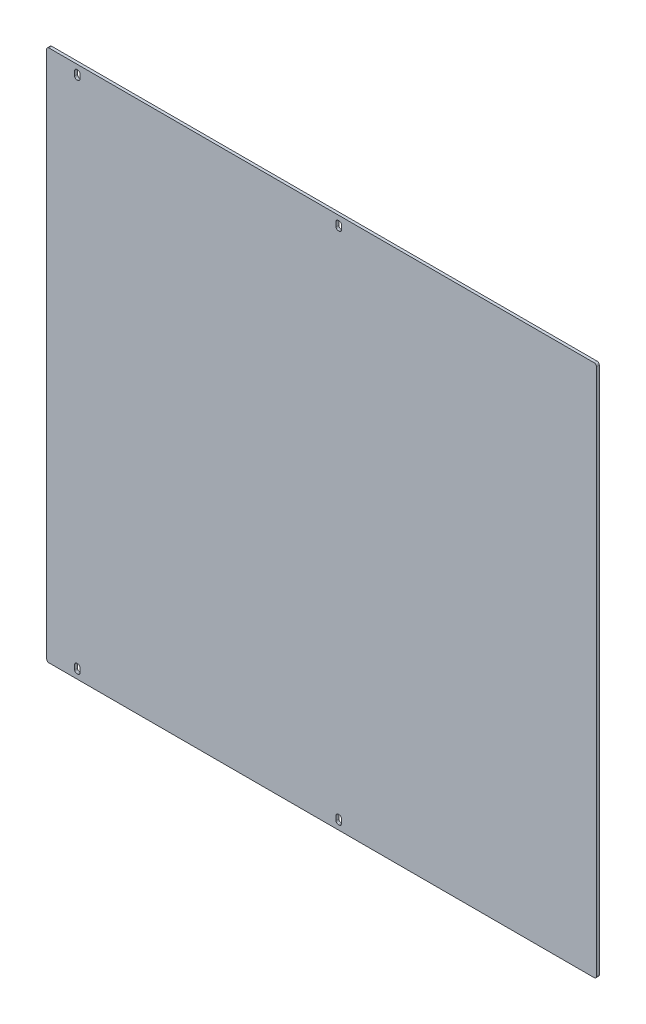
from build123d import *

# Parameters (mm, degrees)
SKETCH1_W           = 609.6
SKETCH1_H           = 590.425
BOSS_EXTRUDE1_DEPTH = 3.175
FILLET1_R           = 2.54
CUT_EXTRUDE1_DEPTH  = 3.175


with BuildPart() as part:
    # Sketch1 → Boss-Extrude1 (new body)
    with BuildSketch(Plane.XY):
        with Locations((79.823295573, -34.486097285)):
            Rectangle(SKETCH1_W, SKETCH1_H)
    extrude(amount=BOSS_EXTRUDE1_DEPTH)

    # Fillet1
    fillet1_edges = [part.edges().sort_by_distance(p)[0] for p in [
        (-224.976704427, 260.726402715, 1.5875),
        (-224.976704427, -329.698597285, 1.5875),
        (384.623295573, -329.698597285, 1.5875),
        (384.623295573, 260.726402715, 1.5875),
    ]]
    fillet(fillet1_edges, radius=FILLET1_R)

    # Sketch2 → Cut-Extrude1 (cut)
    with BuildSketch(Plane.XY.offset(3.175)):
        with BuildLine():
            Line((-190.476704427, 245.604402715), (-191.476704427, 245.604402715))
            ThreePointArc((-191.476704427, 245.604402715), (-193.24447138, 246.336635762), (-193.976704427, 248.104402715))
            Line((-193.976704427, 248.104402715), (-193.976704427, 253.104402715))
            ThreePointArc((-193.976704427, 253.104402715), (-193.24447138, 254.872169668), (-191.476704427, 255.604402715))
            Line((-191.476704427, 255.604402715), (-190.476704427, 255.604402715))
            ThreePointArc((-190.476704427, 255.604402715), (-188.708937474, 254.872169668), (-187.976704427, 253.104402715))
            Line((-187.976704427, 253.104402715), (-187.976704427, 248.104402715))
            ThreePointArc((-187.976704427, 248.104402715), (-188.708937474, 246.336635762), (-190.476704427, 245.604402715))
        make_face()
        with BuildLine():
            Line((99.323295573, 245.604402715), (98.323295573, 245.604402715))
            ThreePointArc((98.323295573, 245.604402715), (96.55552862, 246.336635762), (95.823295573, 248.104402715))
            Line((95.823295573, 248.104402715), (95.823295573, 253.104402715))
            ThreePointArc((95.823295573, 253.104402715), (96.55552862, 254.872169668), (98.323295573, 255.604402715))
            Line((98.323295573, 255.604402715), (99.323295573, 255.604402715))
            ThreePointArc((99.323295573, 255.604402715), (101.091062526, 254.872169668), (101.823295573, 253.104402715))
            Line((101.823295573, 253.104402715), (101.823295573, 248.104402715))
            ThreePointArc((101.823295573, 248.104402715), (101.091062526, 246.336635762), (99.323295573, 245.604402715))
        make_face()
        with BuildLine():
            Line((389.123295573, 245.604402715), (388.123295573, 245.604402715))
            ThreePointArc((388.123295573, 245.604402715), (386.35552862, 246.336635762), (385.623295573, 248.104402715))
            Line((385.623295573, 248.104402715), (385.623295573, 253.104402715))
            ThreePointArc((385.623295573, 253.104402715), (386.35552862, 254.872169668), (388.123295573, 255.604402715))
            Line((388.123295573, 255.604402715), (389.123295573, 255.604402715))
            ThreePointArc((389.123295573, 255.604402715), (390.891062526, 254.872169668), (391.623295573, 253.104402715))
            Line((391.623295573, 253.104402715), (391.623295573, 248.104402715))
            ThreePointArc((391.623295573, 248.104402715), (390.891062526, 246.336635762), (389.123295573, 245.604402715))
        make_face()
        with BuildLine():
            Line((391.623295573, -317.076597285), (391.623295573, -322.076597285))
            ThreePointArc((391.623295573, -322.076597285), (390.891062526, -323.844364238), (389.123295573, -324.576597285))
            Line((389.123295573, -324.576597285), (388.123295573, -324.576597285))
            ThreePointArc((388.123295573, -324.576597285), (386.35552862, -323.844364238), (385.623295573, -322.076597285))
            Line((385.623295573, -322.076597285), (385.623295573, -317.076597285))
            ThreePointArc((385.623295573, -317.076597285), (386.35552862, -315.308830332), (388.123295573, -314.576597285))
            Line((388.123295573, -314.576597285), (389.123295573, -314.576597285))
            ThreePointArc((389.123295573, -314.576597285), (390.891062526, -315.308830332), (391.623295573, -317.076597285))
        make_face()
        with BuildLine():
            Line((101.823295573, -317.076597285), (101.823295573, -322.076597285))
            ThreePointArc((101.823295573, -322.076597285), (101.091062526, -323.844364238), (99.323295573, -324.576597285))
            Line((99.323295573, -324.576597285), (98.323295573, -324.576597285))
            ThreePointArc((98.323295573, -324.576597285), (96.55552862, -323.844364238), (95.823295573, -322.076597285))
            Line((95.823295573, -322.076597285), (95.823295573, -317.076597285))
            ThreePointArc((95.823295573, -317.076597285), (96.55552862, -315.308830332), (98.323295573, -314.576597285))
            Line((98.323295573, -314.576597285), (99.323295573, -314.576597285))
            ThreePointArc((99.323295573, -314.576597285), (101.091062526, -315.308830332), (101.823295573, -317.076597285))
        make_face()
        with BuildLine():
            Line((-187.976704427, -317.076597285), (-187.976704427, -322.076597285))
            ThreePointArc((-187.976704427, -322.076597285), (-188.708937474, -323.844364238), (-190.476704427, -324.576597285))
            Line((-190.476704427, -324.576597285), (-191.476704427, -324.576597285))
            ThreePointArc((-191.476704427, -324.576597285), (-193.24447138, -323.844364238), (-193.976704427, -322.076597285))
            Line((-193.976704427, -322.076597285), (-193.976704427, -317.076597285))
            ThreePointArc((-193.976704427, -317.076597285), (-193.24447138, -315.308830332), (-191.476704427, -314.576597285))
            Line((-191.476704427, -314.576597285), (-190.476704427, -314.576597285))
            ThreePointArc((-190.476704427, -314.576597285), (-188.708937474, -315.308830332), (-187.976704427, -317.076597285))
        make_face()
    extrude(amount=-CUT_EXTRUDE1_DEPTH, mode=Mode.SUBTRACT)


solid = part.part
